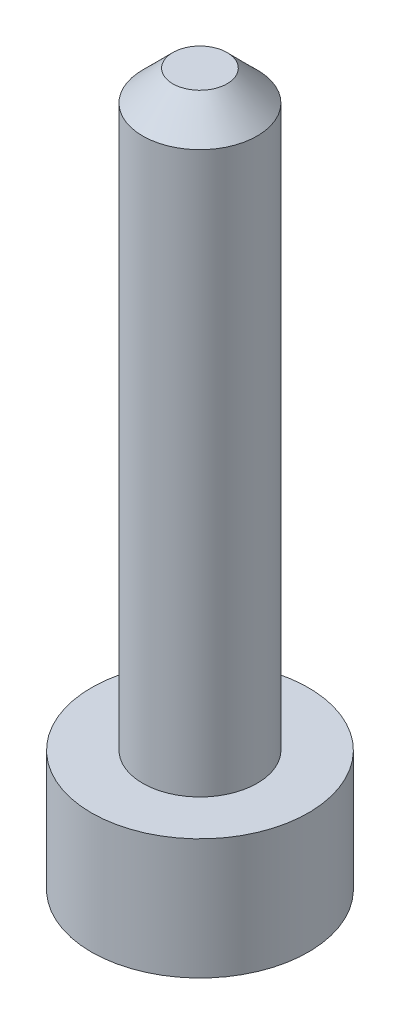
from build123d import *

# Parameters (mm, degrees)
SKETCH1_R           = 1.8
BOSS_EXTRUDE1_DEPTH = 11.8
SKETCH2_OUTSIDE_W   = 8.17
SKETCH2_OUTSIDE_H   = 8.17
SKETCH2_OUTSIDE_R   = 0.95
CUT_EXTRUDE1_DEPTH  = 9.8
CHAMFER1_SIZE       = 0.5
CUT_EXTRUDE2_DEPTH  = 1.5


with BuildPart() as part:
    # Sketch1 → Boss-Extrude1 (new body)
    with BuildSketch(Plane(origin=(0, 0, 0), x_dir=(1, 0, 0), z_dir=(0, 1, 0))):
        Circle(SKETCH1_R)
    extrude(amount=BOSS_EXTRUDE1_DEPTH)

    # Sketch2 outside → Cut-Extrude1 (cut)
    with BuildSketch(Plane(origin=(0, 11.8, 0), x_dir=(1, 0, 0), z_dir=(0, 1, 0))):
        Rectangle(SKETCH2_OUTSIDE_W, SKETCH2_OUTSIDE_H)
        Circle(SKETCH2_OUTSIDE_R, mode=Mode.SUBTRACT)
    extrude(amount=-CUT_EXTRUDE1_DEPTH, mode=Mode.SUBTRACT)

    # Chamfer1
    chamfer1_edges = [part.edges().sort_by_distance(p)[0] for p in [
        (-0.95, 11.8, 0),
    ]]
    chamfer(chamfer1_edges, length=CHAMFER1_SIZE)

    # Sketch8 → Cut-Extrude2 (cut)
    with BuildSketch(Plane.XZ):
        Polygon((1.154700538, 0), (0.577350269, 1), (-0.577350269, 1), (-1.154700538, 0), (-0.577350269, -1), (0.577350269, -1), align=None)
    extrude(amount=-CUT_EXTRUDE2_DEPTH, mode=Mode.SUBTRACT)


solid = part.part
